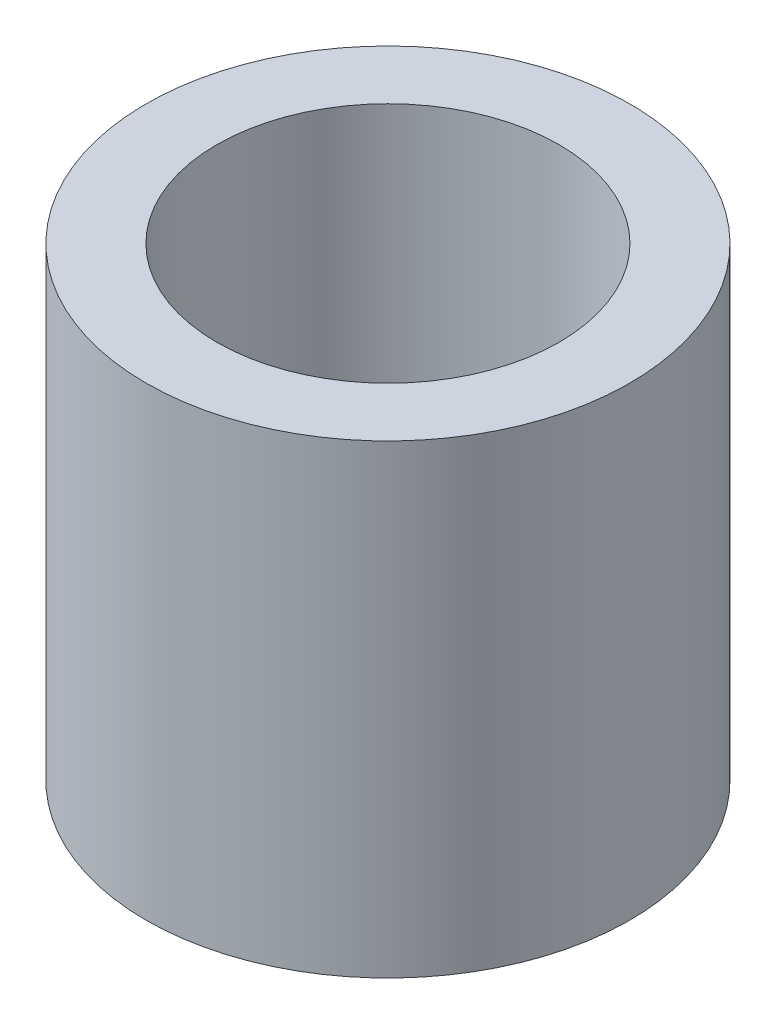
from build123d import *

# Parameters (mm, degrees)
SKETCH1_R           = 1.651
SKETCH1_R_2         = 1.1684
BOSS_EXTRUDE1_DEPTH = 3.175


with BuildPart() as part:
    # Sketch1 → Boss-Extrude1 (new body)
    with BuildSketch(Plane(origin=(0, 0, 0), x_dir=(1, 0, 0), z_dir=(0, 1, 0))):
        with Locations(Location((0, 0, 0), (0, 0, 270))):
            Circle(SKETCH1_R)
        with Locations(Location((0, 0, 0), (0, 0, 270))):
            Circle(SKETCH1_R_2, mode=Mode.SUBTRACT)
    extrude(amount=BOSS_EXTRUDE1_DEPTH)


solid = part.part
